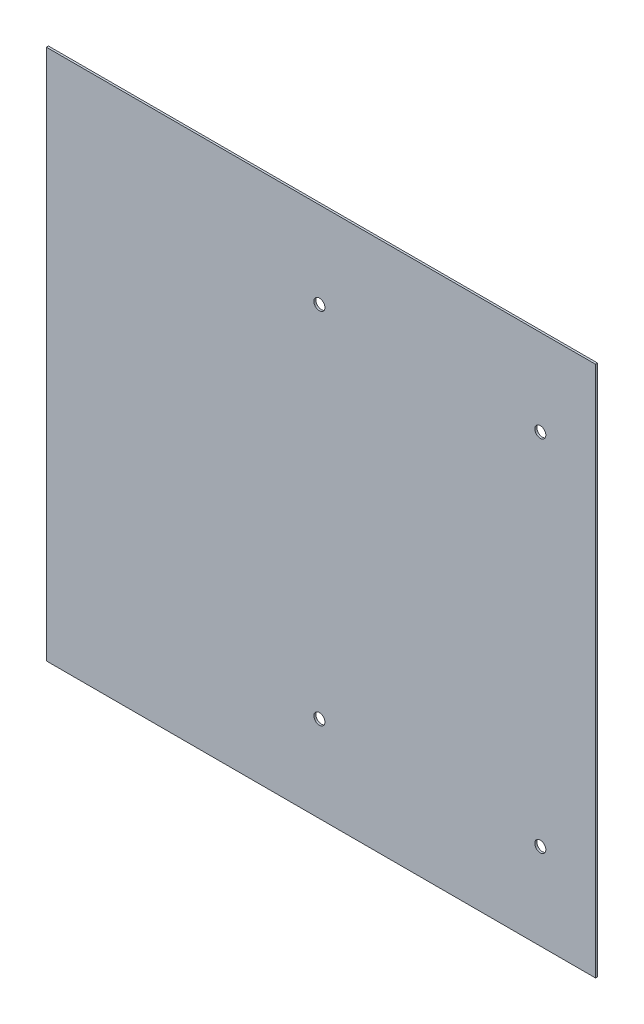
from build123d import *

# Parameters (mm, degrees)
SKETCH1_W           = 397.728686166
SKETCH1_H           = 385
BOSS_EXTRUDE1_DEPTH = 1.5
SKETCH2_R           = 4
CUT_EXTRUDE1_DEPTH  = 1.5


with BuildPart() as part:
    # Sketch1 → Boss-Extrude1 (new body)
    with BuildSketch(Plane.XY):
        with Locations((429.935656917, -192.5)):
            Rectangle(SKETCH1_W, SKETCH1_H)
    extrude(amount=BOSS_EXTRUDE1_DEPTH)

    # Sketch2 → Cut-Extrude1 (cut)
    with BuildSketch(Plane.XY.offset(1.5)):
        with Locations((588.8, -62.5)):
            Circle(SKETCH2_R)
        with Locations(Location((588.8, -322.5, 0), (0, 0, 180))):
            Circle(SKETCH2_R)
        with Locations(Location((428.8, -62.5, 0), (0, 0, 180))):
            Circle(SKETCH2_R)
        with Locations((428.8, -322.5)):
            Circle(SKETCH2_R)
    extrude(amount=-CUT_EXTRUDE1_DEPTH, mode=Mode.SUBTRACT)


solid = part.part
